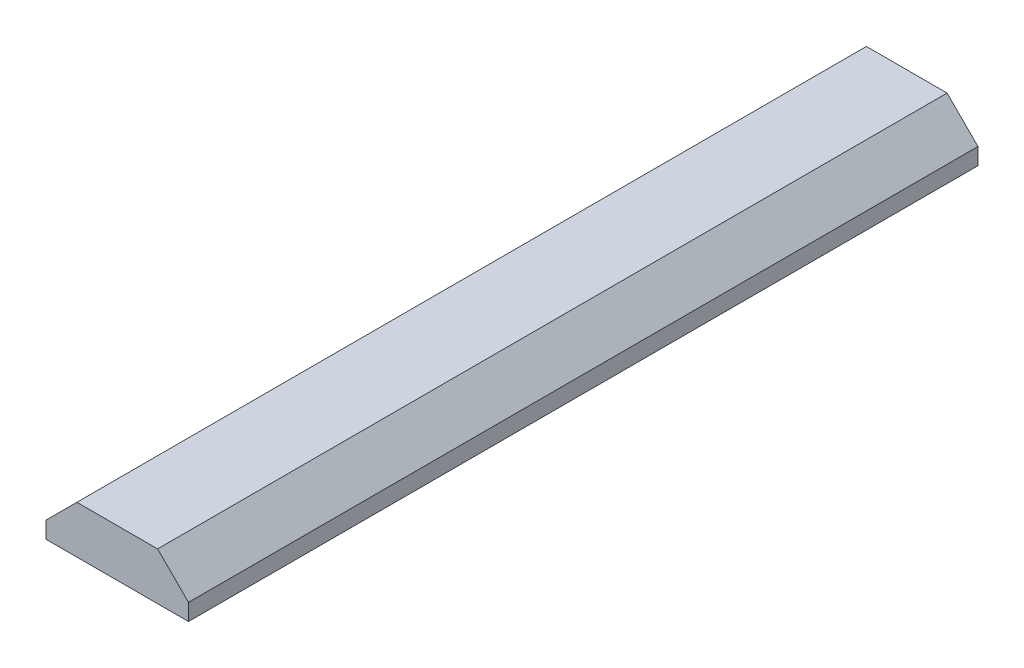
from build123d import *

# Parameters (mm, degrees)
AUFSATZ_LINEAR_AUSTRAGEN1_DEPTH = 66.5


with BuildPart() as part:
    # Skizze1 → Aufsatz-Linear austragen1 (new body)
    with BuildSketch(Plane.XY):
        Polygon((3.4, 1.808858787), (-3.4, 1.808858787), (-6, -0.791141213), (-6, -2.191141213), (6, -2.191141213), (6, -0.791141213), align=None)
    extrude(amount=AUFSATZ_LINEAR_AUSTRAGEN1_DEPTH)


solid = part.part
